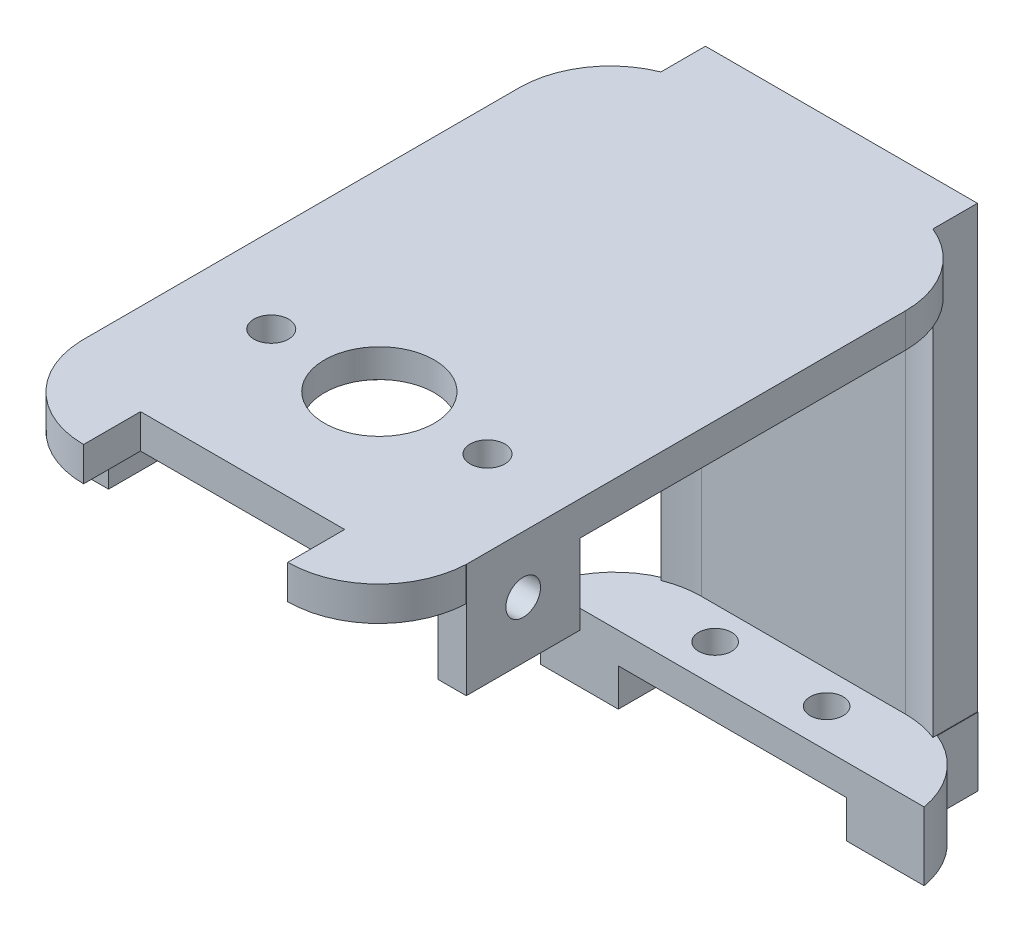
from build123d import *

# Parameters (mm, degrees)
BOSS_EXTRUDE2_DEPTH = 3
FILLET2_R           = 8
BOSS_EXTRUDE3_DEPTH = 44.7
SKETCH4_R           = 1.45
BOSS_EXTRUDE4_DEPTH = 6
SKETCH5_W           = 20.05
SKETCH5_H           = 7.70975521
SKETCH5_R           = 1.45
CUT_EXTRUDE2_DEPTH  = 3.3
BOSS_EXTRUDE5_REACH = 77.442
SKETCH7_W           = 10
SKETCH7_H           = 10
SKETCH7_R           = 1.525
CUT_EXTRUDE3_REACH  = 84.621
SKETCH8_W           = 28.937408921
SKETCH8_H           = 10
SKETCH11_R          = 1.525
SKETCH11_R_2        = 4.825
CUT_EXTRUDE4_DEPTH  = 3
SKETCH12_R          = 5.525
CUT_EXTRUDE5_DEPTH  = 0.5
SKETCH14_W          = 17.937492396
SKETCH14_H          = 5
CUT_EXTRUDE6_DEPTH  = 3


with BuildPart() as part:
    # Sketch2 → Boss-Extrude2 (new body)
    with BuildSketch(Plane(origin=(0, 0, 0), x_dir=(1, 0, 0), z_dir=(0, 1, 0))):
        Polygon((-53.10956872, -52.91705805), (-53.124237768, 1.36911662), (-19.174237768, 1.36911662), (-19.174237768, -52.91705805), align=None)
    extrude(amount=BOSS_EXTRUDE2_DEPTH)

    # Fillet2
    fillet2_edges = [part.edges().sort_by_distance(p)[0] for p in [
        (-53.10956872, 1.5, 52.91705805),
        (-53.124237768, 1.5, -1.36911662),
        (-19.174237768, 1.5, -1.36911662),
        (-19.174237768, 1.5, 52.91705805),
    ]]
    fillet(fillet2_edges, radius=FILLET2_R)

    # Sketch3 → Boss-Extrude3 (add)
    with BuildSketch(Plane(origin=(0, 3, 0), x_dir=(1, 0, 0), z_dir=(0, 1, 0))):
        with BuildLine():
            Line((-48.098156754, 4.70911662), (-24.198156754, 4.70911662))
            Line((-24.198156754, 4.70911662), (-24.198156754, 0.794945988))
            ThreePointArc((-24.198156754, 0.794945988), (-25.658756812, 1.224262543), (-27.174237768, 1.36911662))
            Line((-27.174237768, 1.36911662), (-45.12207574, 1.36911662))
            ThreePointArc((-45.12207574, 1.36911662), (-46.637556696, 1.224262543), (-48.098156754, 0.794945988))
            Line((-48.098156754, 0.794945988), (-48.098156754, 4.70911662))
        make_face()
    extrude(amount=-BOSS_EXTRUDE3_DEPTH)

    # Sketch4 → Boss-Extrude4 (add)
    with BuildSketch(Plane.XZ.offset(41.7)):
        with BuildLine():
            Line((-48.148156754, -1.125315107), (-48.148156754, -4.70911662))
            Line((-48.148156754, -4.70911662), (-24.148156754, -4.70911662))
            Line((-24.148156754, -4.70911662), (-24.148156754, -1.125315107))
            ThreePointArc((-24.148156754, -1.125315107), (-20.947846297, 1.245451192), (-19.298979621, 4.87088338))
            Line((-19.298979621, 4.87088338), (-52.997333887, 4.87088338))
            ThreePointArc((-52.997333887, 4.87088338), (-51.348467211, 1.245451192), (-48.148156754, -1.125315107))
        make_face()
        with Locations(Location((-41.048156754, 1.49088338, 0), (0, 0, 270))):
            Circle(SKETCH4_R, mode=Mode.SUBTRACT)
        with Locations(Location((-31.248156754, 1.49088338, 0), (0, 0, 270))):
            Circle(SKETCH4_R, mode=Mode.SUBTRACT)
    extrude(amount=-BOSS_EXTRUDE4_DEPTH)

    # Sketch5 → Cut-Extrude2 (cut)
    with BuildSketch(Plane.XZ.offset(41.7)):
        with Locations((-36.148152634, 1.016005775)):
            Rectangle(SKETCH5_W, SKETCH5_H)
        with Locations(Location((-31.248156754, 1.49088338, 0), (0, 0, 270))):
            Circle(SKETCH5_R, mode=Mode.SUBTRACT)
        with Locations(Location((-41.048156754, 1.49088338, 0), (0, 0, 270))):
            Circle(SKETCH5_R, mode=Mode.SUBTRACT)
    extrude(amount=-CUT_EXTRUDE2_DEPTH, mode=Mode.SUBTRACT)

    # Boss-Extrude5: up to this face of the body (flat: up to its plane)
    boss_extrude5_end = Plane(part.part.faces().sort_by_distance((-53.11690266, 1.5, 25.776132451))[0])
    # Sketch7 → Boss-Extrude5 (add, up to the picked face)
    with BuildSketch(Plane(origin=(-19.174237768, 0, 0), x_dir=(0, 0, -1), z_dir=(1, 0, 0)), mode=Mode.PRIVATE) as boss_extrude5_sk1:
        with Locations((-40.22705805, -2)):
            Rectangle(SKETCH7_W, SKETCH7_H)
        with Locations((-40.22705805, -2)):
            Circle(SKETCH7_R, mode=Mode.SUBTRACT)
    boss_extrude5_tool1 = split(extrude(boss_extrude5_sk1.sketch, amount=-BOSS_EXTRUDE5_REACH, mode=Mode.PRIVATE), bisect_by=boss_extrude5_end, keep=Keep.BOTH, mode=Mode.PRIVATE)
    add(boss_extrude5_tool1.solids().sort_by(Axis((-19.174238, 2.858579, 40.227058), (-1, 0, 0)))[0])

    # Cut-Extrude3: up to this face of the body (flat: up to its plane)
    cut_extrude3_end = Plane(part.part.faces().sort_by_distance((-36.146613335, 0, 17.301528841))[0])
    # Sketch8 → Cut-Extrude3 (cut, up to the picked face)
    with BuildSketch(Plane.XZ.offset(7), mode=Mode.PRIVATE) as cut_extrude3_sk1:
        with Locations((-36.142942229, 40.22705805)):
            Rectangle(SKETCH8_W, SKETCH8_H)
    cut_extrude3_tool1 = split(extrude(cut_extrude3_sk1.sketch, amount=-CUT_EXTRUDE3_REACH, mode=Mode.PRIVATE), bisect_by=cut_extrude3_end, keep=Keep.BOTH, mode=Mode.PRIVATE)
    add(cut_extrude3_tool1.solids().sort_by(Axis((-36.142942, -7, 40.227058), (0, 1, 0)))[0], mode=Mode.SUBTRACT)

    # Sketch11 → Cut-Extrude4 (cut)
    with BuildSketch(Plane.XZ):
        with Locations(Location((-45.644202791, 35.897058093, 0), (0, 0, 270))):
            Circle(SKETCH11_R)
        with Locations(Location((-26.644202791, 35.897058093, 0), (0, 0, 270))):
            Circle(SKETCH11_R)
        with Locations(Location((-36.144202791, 35.897058093, 0), (0, 0, 270))):
            Circle(SKETCH11_R_2)
    extrude(amount=-CUT_EXTRUDE4_DEPTH, mode=Mode.SUBTRACT)

    # Sketch12 → Cut-Extrude5 (cut)
    with BuildSketch(Plane.XZ):
        with Locations(Location((-36.144202791, 35.897058093, 0), (0, 0, 270))):
            Circle(SKETCH12_R)
    extrude(amount=-CUT_EXTRUDE5_DEPTH, mode=Mode.SUBTRACT)

    # Sketch14 → Cut-Extrude6 (cut)
    with BuildSketch(Plane(origin=(0, 3, 0), x_dir=(1, 0, 0), z_dir=(0, 1, 0))):
        with Locations((-36.142983966, -50.41705805)):
            Rectangle(SKETCH14_W, SKETCH14_H)
    extrude(amount=-CUT_EXTRUDE6_DEPTH, mode=Mode.SUBTRACT)


solid = part.part
